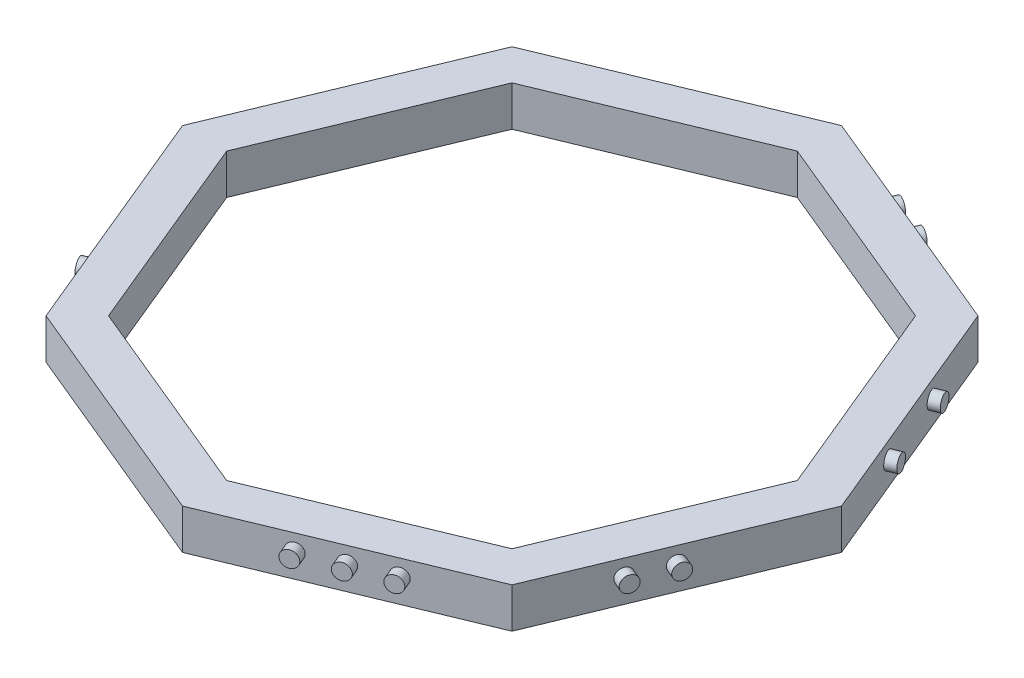
from build123d import *

# Parameters (mm, degrees)
BOSS_EXTRUDE1_DEPTH  = 5
CUT_EXTRUDE1_DEPTH   = 5
SKETCH6_R            = 1
BOSS_EXTRUDE5_DEPTH  = 1.25
SKETCH7_R            = 1
BOSS_EXTRUDE6_DEPTH  = 1.25
SKETCH8_R            = 1
BOSS_EXTRUDE7_DEPTH  = 1.25
BOSS_EXTRUDE8_START  = 1.25
SKETCH9_R            = 1
BOSS_EXTRUDE8_DEPTH  = 1.25
SKETCH10_R           = 1
BOSS_EXTRUDE12_DEPTH = 1.25
BOSS_EXTRUDE13_START = 1.25
SKETCH11_R           = 1
BOSS_EXTRUDE13_DEPTH = 1.25
BOSS_EXTRUDE14_START = 1.25
SKETCH12_R           = 1
BOSS_EXTRUDE14_DEPTH = 1.25


with BuildPart() as part:
    # Sketch3 → Boss-Extrude1 (new body)
    with BuildSketch(Plane(origin=(0, 0, 0), x_dir=(1, 0, 0), z_dir=(0, 1, 0))):
        Polygon((41, 0), (28.991378029, 28.991378029), (0, 41), (-28.991378029, 28.991378029), (-41, 0), (-28.991378029, -28.991378029), (0, -41), (28.991378029, -28.991378029), align=None)
    extrude(amount=BOSS_EXTRUDE1_DEPTH)

    # Sketch5 → Cut-Extrude1 (cut)
    with BuildSketch(Plane(origin=(0, 5, 0), x_dir=(1, 0, 0), z_dir=(0, 1, 0))):
        Polygon((35.5, 0), (25.102290732, 25.102290732), (0, 35.5), (-25.102290732, 25.102290732), (-35.5, 0), (-25.102290732, -25.102290732), (0, -35.5), (25.102290732, -25.102290732), align=None)
    extrude(amount=-CUT_EXTRUDE1_DEPTH, mode=Mode.SUBTRACT)

    # Sketch6 → Boss-Extrude5 (add)
    with BuildSketch(Plane(origin=(14.495689014, 0, 34.995689014), x_dir=(0.9238795325112827, 0, -0.38268343236509966), z_dir=(0.38268343236509966, 0, 0.9238795325112827))):
        with Locations(Location((0, 3, 0), (0, 0, 180))):
            Circle(SKETCH6_R)
        with Locations(Location((-5, 3, 0), (0, 0, 180))):
            Circle(SKETCH6_R)
        with Locations(Location((5, 3, 0), (0, 0, 180))):
            Circle(SKETCH6_R)
    extrude(amount=BOSS_EXTRUDE5_DEPTH)

    # Sketch7 → Boss-Extrude6 (add)
    with BuildSketch(Plane(origin=(-34.995689014, 0, 14.495689014), x_dir=(0.3826834323650997, 0, 0.9238795325112827), z_dir=(-0.9238795325112827, 0, 0.3826834323650997))):
        with Locations(Location((5, 3, 0), (0, 0, 180))):
            Circle(SKETCH7_R)
    extrude(amount=BOSS_EXTRUDE6_DEPTH)

    # Sketch8 → Boss-Extrude7 (add)
    with BuildSketch(Plane(origin=(-34.995689014, 0, -14.495689014), x_dir=(-0.3826834323650795, 0, 0.9238795325112911), z_dir=(-0.9238795325112911, 0, -0.3826834323650795))):
        with Locations(Location((0, 3, 0), (0, 0, 180))):
            Circle(SKETCH8_R)
    extrude(amount=BOSS_EXTRUDE7_DEPTH)

    # Sketch9 → Boss-Extrude8 (add)
    with BuildSketch(Plane(origin=(-14.495689014, 0, -34.995689014), x_dir=(-0.9238795325112826, 0, 0.38268343236509983), z_dir=(-0.38268343236509983, 0, -0.9238795325112826)).offset(BOSS_EXTRUDE8_START)):
        with Locations((-5, 3)):
            Circle(SKETCH9_R)
    extrude(amount=-BOSS_EXTRUDE8_DEPTH)

    # Sketch10 → Boss-Extrude12 (add)
    with BuildSketch(Plane(origin=(14.495689014, 0, -34.995689014), x_dir=(-0.923879532511291, 0, -0.38268343236507973), z_dir=(0.38268343236507973, 0, -0.923879532511291))):
        with Locations(Location((0, 3, 0), (0, 0, 180))):
            Circle(SKETCH10_R)
        with Locations(Location((5, 3, 0), (0, 0, 180))):
            Circle(SKETCH10_R)
    extrude(amount=BOSS_EXTRUDE12_DEPTH)

    # Sketch11 → Boss-Extrude13 (add)
    with BuildSketch(Plane(origin=(34.995689014, 0, -14.495689014), x_dir=(-0.3826834323651001, 0, -0.9238795325112825), z_dir=(0.9238795325112824, 0, -0.38268343236510005)).offset(BOSS_EXTRUDE13_START)):
        with Locations(Location((5, 3, 0), (0, 0, 180))):
            Circle(SKETCH11_R)
        with Locations((-5, 3)):
            Circle(SKETCH11_R)
    extrude(amount=-BOSS_EXTRUDE13_DEPTH)

    # Sketch12 → Boss-Extrude14 (add)
    with BuildSketch(Plane(origin=(34.995689014, 0, 14.495689014), x_dir=(0.3826834323650795, 0, -0.923879532511291), z_dir=(0.9238795325112911, 0, 0.38268343236507957)).offset(BOSS_EXTRUDE14_START)):
        with Locations((0, 3)):
            Circle(SKETCH12_R)
        with Locations(Location((-5, 3, 0), (0, 0, 180))):
            Circle(SKETCH12_R)
    extrude(amount=-BOSS_EXTRUDE14_DEPTH)


solid = part.part
